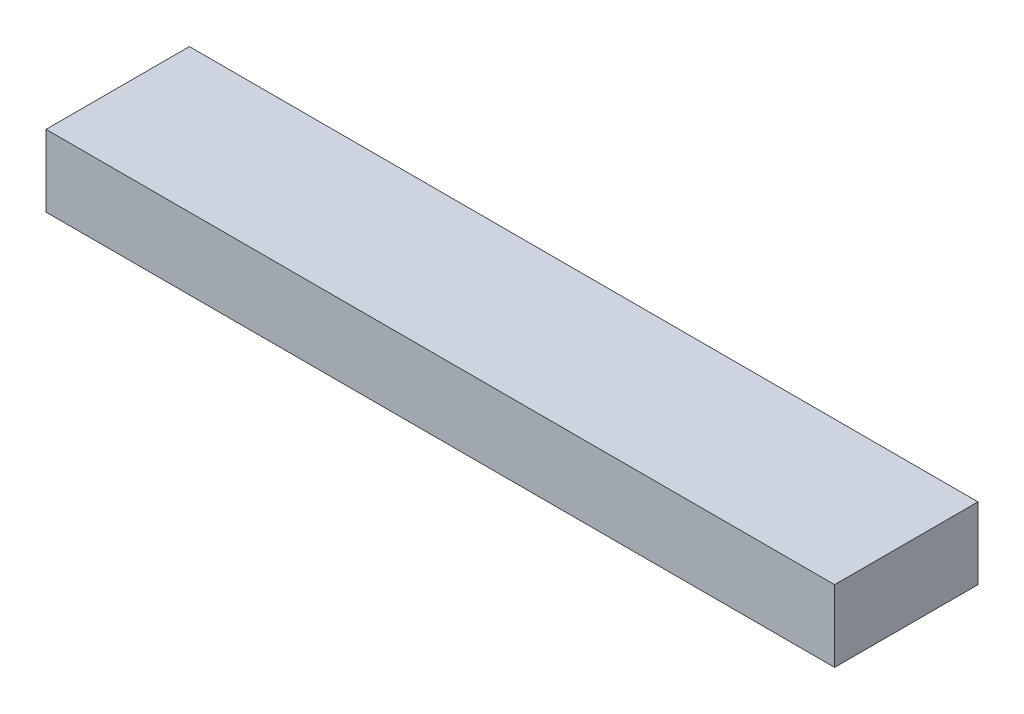
from build123d import *

# Parameters (mm, degrees)
SKETCH1_W           = 55
SKETCH1_H           = 10
BOSS_EXTRUDE1_DEPTH = 5


with BuildPart() as part:
    # Sketch1 → Boss-Extrude1 (new body)
    with BuildSketch(Plane(origin=(0, 0, 0), x_dir=(1, 0, 0), z_dir=(0, 1, 0))):
        with Locations((-27.5, 5)):
            Rectangle(SKETCH1_W, SKETCH1_H)
    extrude(amount=BOSS_EXTRUDE1_DEPTH)


solid = part.part
